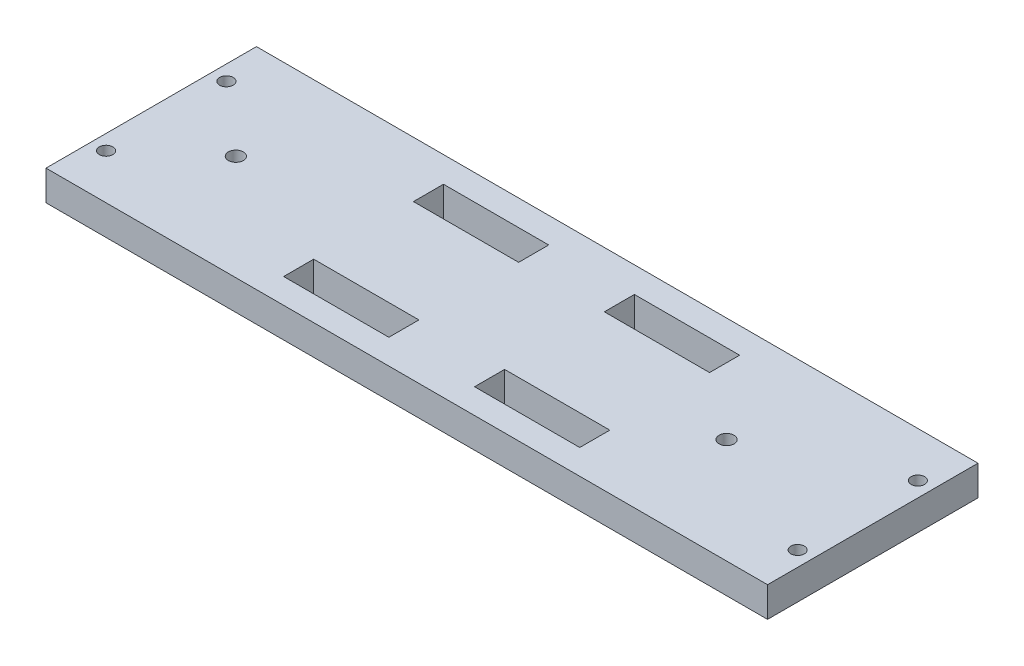
from build123d import *

# Parameters (mm, degrees)
CROQUIS1_W              = 240
CROQUIS1_H              = 70
SALIENTE_EXTRUIR1_DEPTH = 5
CROQUIS2_R              = 2.25
CORTAR_EXTRUIR1_DEPTH   = 126.39936204
CROQUIS5_W              = 35
CROQUIS5_H              = 10
CORTAR_EXTRUIR4_DEPTH   = 126.39936204
CROQUIS6_R              = 2.5
CORTAR_EXTRUIR5_DEPTH   = 126.39936204


with BuildPart() as part:
    # Croquis1 → Saliente-Extruir1 (new, symmetric)
    with BuildSketch(Plane(origin=(0, 0, 0), x_dir=(1, 0, 0), z_dir=(0, 1, 0))):
        Rectangle(CROQUIS1_W, CROQUIS1_H)
    extrude(amount=SALIENTE_EXTRUIR1_DEPTH, both=True)

    # Croquis2 → Cortar-Extruir1 (cut, through all)
    with BuildSketch(Plane(origin=(0, 5, 0), x_dir=(1, 0, 0), z_dir=(0, 1, 0))):
        with Locations(Location((-115, 20, 0), (0, 0, 270))):
            Circle(CROQUIS2_R)
        with Locations(Location((-115, -20, 0), (0, 0, 270))):
            Circle(CROQUIS2_R)
        with Locations(Location((115, -20, 0), (0, 0, 90))):
            Circle(CROQUIS2_R)
        with Locations(Location((115, 20, 0), (0, 0, 90))):
            Circle(CROQUIS2_R)
    extrude(amount=-CORTAR_EXTRUIR1_DEPTH, mode=Mode.SUBTRACT)

    # Croquis5 → Cortar-Extruir4 (cut, through all)
    with BuildSketch(Plane(origin=(0, 5, 0), x_dir=(1, 0, 0), z_dir=(0, 1, 0))):
        with Locations((-31.75, 21.46)):
            Rectangle(CROQUIS5_W, CROQUIS5_H)
        with Locations((-31.75, -21.71)):
            Rectangle(CROQUIS5_W, CROQUIS5_H)
        with Locations((31.75, 21.46)):
            Rectangle(CROQUIS5_W, CROQUIS5_H)
        with Locations((31.75, -21.71)):
            Rectangle(CROQUIS5_W, CROQUIS5_H)
    extrude(amount=-CORTAR_EXTRUIR4_DEPTH, mode=Mode.SUBTRACT)

    # Croquis6 → Cortar-Extruir5 (cut, through all)
    with BuildSketch(Plane(origin=(0, 5, 0), x_dir=(1, 0, 0), z_dir=(0, 1, 0))):
        with Locations(Location((71.38, 0, 0), (0, 0, 270))):
            Circle(CROQUIS6_R)
        with Locations(Location((-91.85, 0, 0), (0, 0, 270))):
            Circle(CROQUIS6_R)
    extrude(amount=-CORTAR_EXTRUIR5_DEPTH, mode=Mode.SUBTRACT)


solid = part.part
